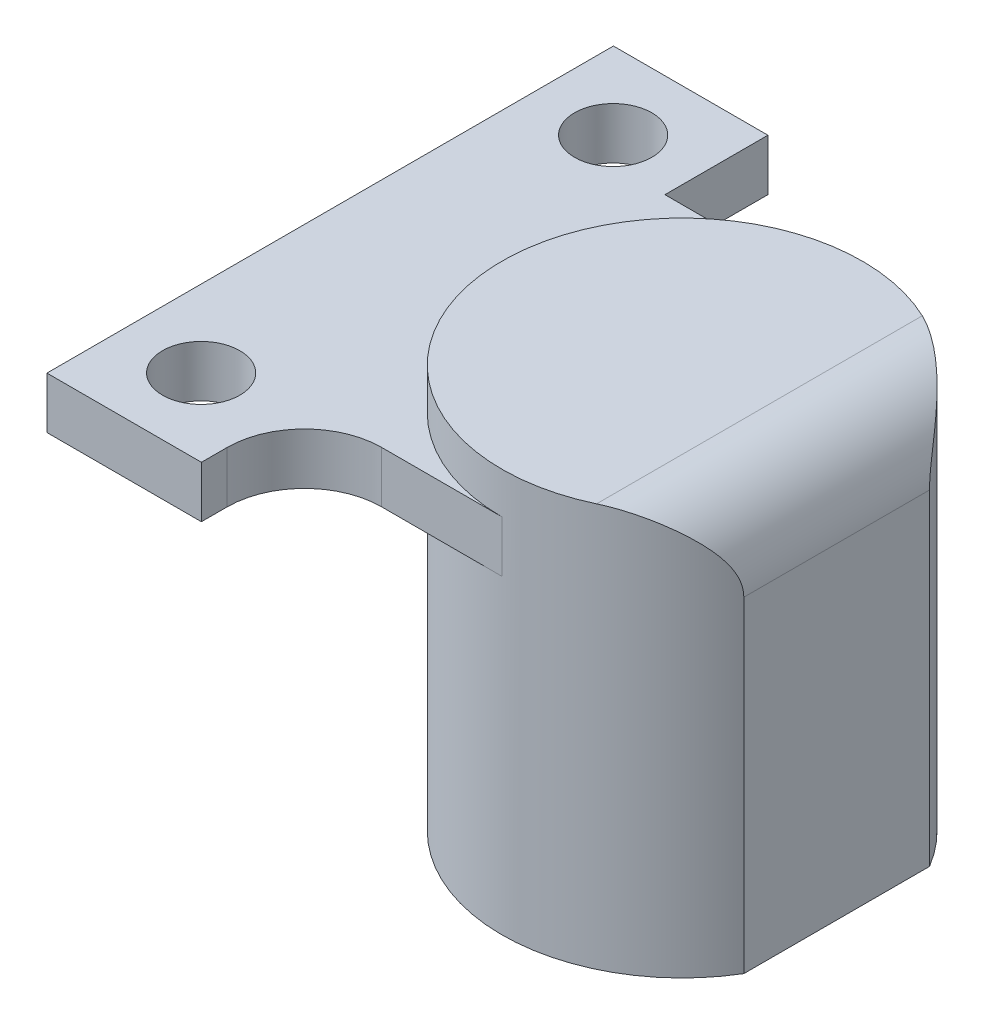
from build123d import *
from build123d.topology import SkipClean

# Parameters (mm, degrees)
SKETCH1_R           = 7
SKETCH1_R_2         = 5.2
BOSS_EXTRUDE1_DEPTH = 15.66
BOSS_EXTRUDE2_START = -3.6
SKETCH2_W           = 6
SKETCH2_H           = 4
BOSS_EXTRUDE2_DEPTH = 3.6
CUT_EXTRUDE2_START  = -1.6
SKETCH2_3_W         = 6
SKETCH2_3_H         = 4
CUT_EXTRUDE2_DEPTH  = 1.6
SKETCH4_R           = 1.5
CUT_EXTRUDE1_DEPTH  = 10
FILLET7_R           = 3
BOSS_EXTRUDE3_START = -1
SKETCH5_R           = 5.2
BOSS_EXTRUDE3_DEPTH = 1
CUT_EXTRUDE3_DEPTH  = 15.66
FILLET8_R           = 3


with BuildPart() as part:
    # Sketch1 → Boss-Extrude1 (new body)
    with BuildSketch(Plane(origin=(0, 0, 0), x_dir=(1, 0, 0), z_dir=(0, 1, 0))):
        with Locations(Location((0, 0, 0), (0, 0, 270))):
            Circle(SKETCH1_R)
        with Locations(Location((0, 0, 0), (0, 0, 270))):
            Circle(SKETCH1_R_2, mode=Mode.SUBTRACT)
    extrude(amount=BOSS_EXTRUDE1_DEPTH)

    # Sketch2 → Boss-Extrude2 (add)
    with BuildSketch(Plane(origin=(0, 15.66, 0), x_dir=(1, 0, 0), z_dir=(0, 1, 0)).offset(BOSS_EXTRUDE2_START)):
        with Locations((-10.67, -9)):
            Rectangle(SKETCH2_W, SKETCH2_H)
        with BuildLine():
            ThreePointArc((0, -7), (-7, 0), (0, 7))
            Line((0, 7), (-7.67, 7))
            Line((-7.67, 7), (-13.67, 7))
            Line((-13.67, 7), (-13.67, -7))
            Line((-13.67, -7), (-7.67, -7))
            Line((-7.67, -7), (0, -7))
        make_face()
        with Locations((-10.67, 9)):
            Rectangle(SKETCH2_W, SKETCH2_H)
    extrude(amount=BOSS_EXTRUDE2_DEPTH)

    # Sketch2<3> → Cut-Extrude2 (cut)
    with SkipClean():  # the faces are left unmerged after this step: merging them gives an invalid solid
        with BuildSketch(Plane(origin=(0, 15.66, 0), x_dir=(1, 0, 0), z_dir=(0, 1, 0)).offset(CUT_EXTRUDE2_START)):
            with BuildLine():
                ThreePointArc((0, -7), (-7, 0), (0, 7))
                Line((0, 7), (-7.67, 7))
                Line((-7.67, 7), (-13.67, 7))
                Line((-13.67, 7), (-13.67, -7))
                Line((-13.67, -7), (-7.67, -7))
                Line((-7.67, -7), (0, -7))
            make_face()
            with Locations((-10.67, 9)):
                Rectangle(SKETCH2_3_W, SKETCH2_3_H)
            with Locations((-10.67, -9)):
                Rectangle(SKETCH2_3_W, SKETCH2_3_H)
        extrude(amount=CUT_EXTRUDE2_DEPTH, mode=Mode.SUBTRACT)

    # Sketch4 → Cut-Extrude1 (cut)
    with SkipClean():  # the faces are left unmerged after this step: merging them gives an invalid solid
        with BuildSketch(Plane.XZ.offset(-12.06)):
            with Locations(Location((-10.68, -8, 0), (0, 0, 270))):
                Circle(SKETCH4_R)
            with Locations(Location((-10.68, 8, 0), (0, 0, 270))):
                Circle(SKETCH4_R)
        extrude(amount=-CUT_EXTRUDE1_DEPTH, mode=Mode.SUBTRACT)

    # Fillet7
    fillet7_edges = [part.edges().sort_by_distance(p)[0] for p in [
        (-7.67, 13.06, 7),
    ]]
    fillet(fillet7_edges, radius=FILLET7_R)

    # Sketch5 → Boss-Extrude3 (add)
    with SkipClean():  # the faces are left unmerged after this step: merging them gives an invalid solid
        with BuildSketch(Plane(origin=(0, 15.66, 0), x_dir=(1, 0, 0), z_dir=(0, 1, 0)).offset(BOSS_EXTRUDE3_START)):
            with Locations(Location((0, 0, 0), (0, 0, 270))):
                Circle(SKETCH5_R)
        extrude(amount=BOSS_EXTRUDE3_DEPTH)

    # Sketch6 → Cut-Extrude3 (cut)
    with BuildSketch(Plane.XZ):
        with BuildLine():
            Line((6, -3.605551275), (6, 3.605551275))
            ThreePointArc((6, 3.605551275), (7, 0), (6, -3.605551275))
        make_face()
    extrude(amount=-CUT_EXTRUDE3_DEPTH, mode=Mode.SUBTRACT)

    # Fillet8
    fillet8_edges = [part.edges().sort_by_distance(p)[0] for p in [
        (6, 15.66, 0),
    ]]
    fillet(fillet8_edges, radius=FILLET8_R)


solid = part.part
